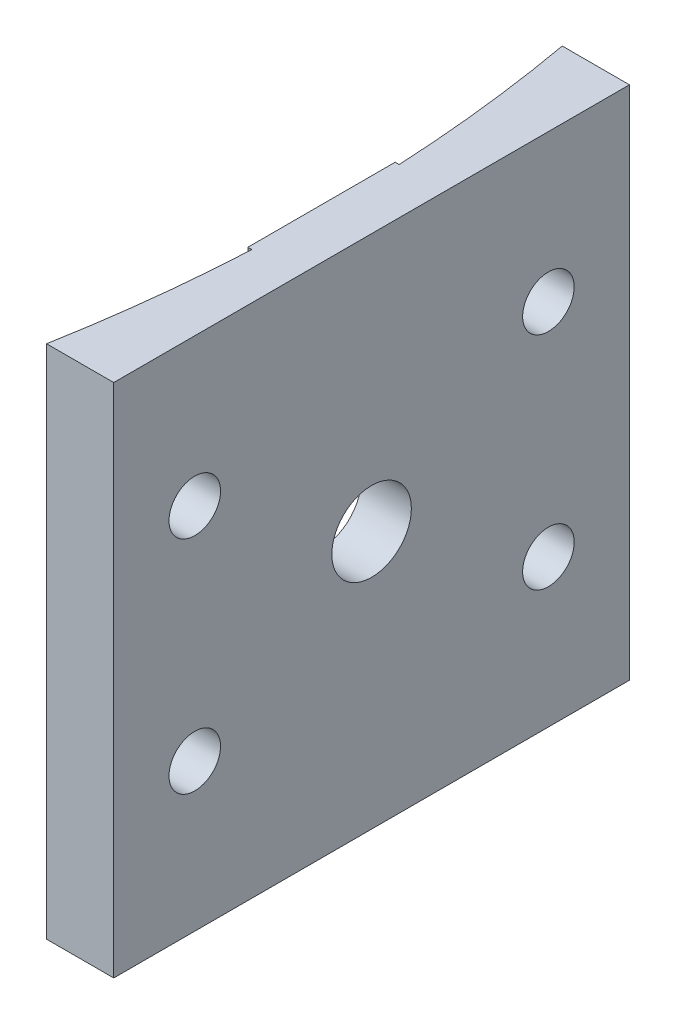
from build123d import *

# Parameters (mm, degrees)
EXTRUDE_1_DEPTH     = 35
SKETCH_2_R          = 1.75
CUT_EXTRUDE_1_DEPTH = 40.39586793
SKETCH_3_W          = 0.8
SKETCH_3_H          = 10
EXTRUDE_2_DEPTH     = 35
SKETCH_4_R          = 2.7
CUT_EXTRUDE_2_DEPTH = 40.395868074


with BuildPart() as part:
    # Эскиз1 → Бобышка-Вытянуть1 (new body)
    with BuildSketch(Plane(origin=(0, 0, 0), x_dir=(1, 0, 0), z_dir=(0, 1, 0))):
        with BuildLine():
            Line((-4.558992206, 17.5), (0, 17.5))
            Line((0, 17.5), (0, -17.5))
            Line((0, -17.5), (-4.558992206, -17.5))
            ThreePointArc((-4.558992206, -17.5), (-3, 0), (-4.558992206, 17.5))
        make_face()
    extrude(amount=EXTRUDE_1_DEPTH)

    # Эскиз2 → Вырез-Вытянуть1 (cut, through all)
    with BuildSketch(Plane(origin=(0, 0, 0), x_dir=(0, 0, -1), z_dir=(1, 0, 0))):
        with Locations((-12, 25)):
            Circle(SKETCH_2_R)
        with Locations((12, 25)):
            Circle(SKETCH_2_R)
        with Locations((12, 10)):
            Circle(SKETCH_2_R)
        with Locations((-12, 10)):
            Circle(SKETCH_2_R)
    extrude(amount=-CUT_EXTRUDE_1_DEPTH, mode=Mode.SUBTRACT)

    # Эскиз3 → Бобышка-Вытянуть2 (add)
    with BuildSketch(Plane.XZ):
        with Locations((-3, 0)):
            Rectangle(SKETCH_3_W, SKETCH_3_H)
    extrude(amount=-EXTRUDE_2_DEPTH)

    # Эскиз4 → Вырез-Вытянуть2 (cut, through all)
    with BuildSketch(Plane(origin=(0, 0, 0), x_dir=(0, 0, -1), z_dir=(1, 0, 0))):
        with Locations((0, 17.5)):
            Circle(SKETCH_4_R)
    extrude(amount=-CUT_EXTRUDE_2_DEPTH, mode=Mode.SUBTRACT)


solid = part.part
